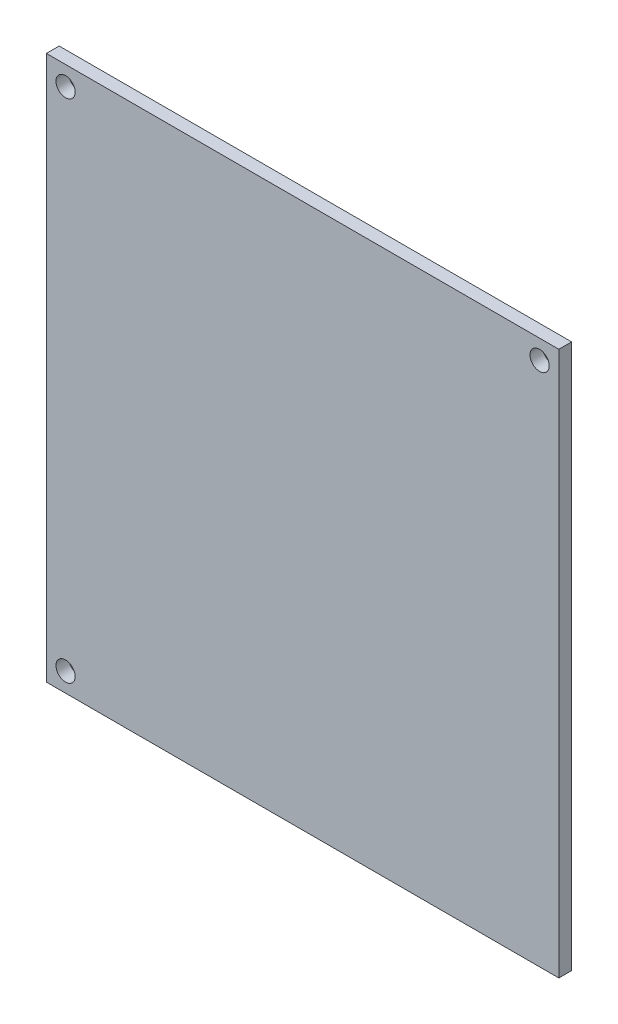
from build123d import *

# Parameters (mm, degrees)
IZIM1_W                     = 80
IZIM1_H                     = 85
IZIM1_R                     = 1.5
Y_KSEKLIK_EKSTR_ZYON1_DEPTH = 2


with BuildPart() as part:
    # Çizim1 → Yükseklik-Ekstrüzyon1 (new body)
    with BuildSketch(Plane.XY):
        with Locations((40, 42.5)):
            Rectangle(IZIM1_W, IZIM1_H)
        with Locations((3, 3)):
            Circle(IZIM1_R, mode=Mode.SUBTRACT)
        with Locations((77, 82)):
            Circle(IZIM1_R, mode=Mode.SUBTRACT)
        with Locations((3, 82)):
            Circle(IZIM1_R, mode=Mode.SUBTRACT)
    extrude(amount=Y_KSEKLIK_EKSTR_ZYON1_DEPTH)


solid = part.part
